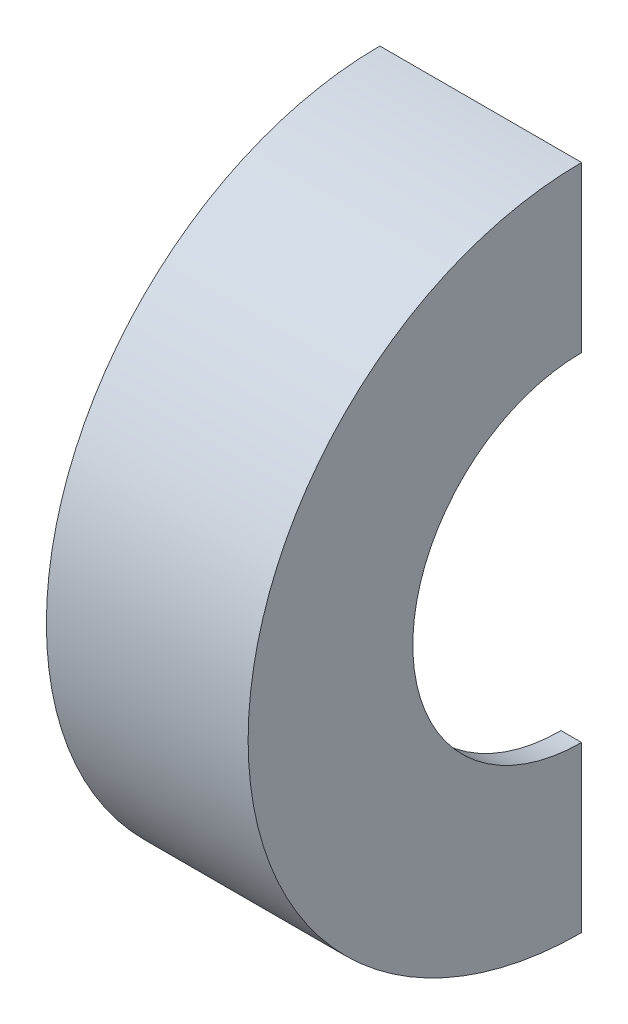
from build123d import *

# Parameters (mm, degrees)
REVOLVE_1_ANGLE = 180


with BuildPart() as part:
    # 草图1 → 旋转1 (revolve)
    with BuildSketch(Plane.XY):
        Polygon((0, 82), (0, 162), (98, 162), (98, 82), (88, 82), (88, 152), (10, 152), (10, 82), align=None)
    revolve(axis=Axis((0, 0, 0), (1, 0, 0)), revolution_arc=REVOLVE_1_ANGLE)


solid = part.part
